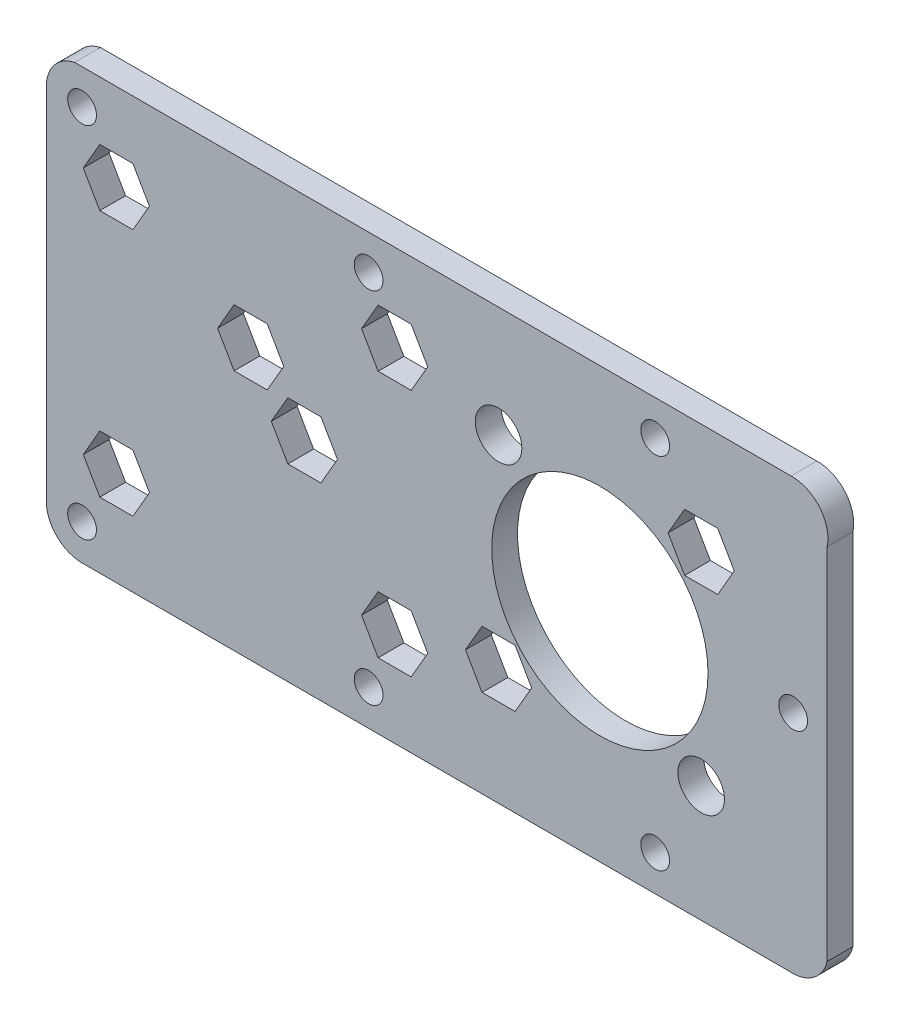
from build123d import *

# Parameters (mm, degrees)
SKETCH1_R           = 2.5527
SKETCH1_R_2         = 4.1275
SKETCH1_R_3         = 19.177
BOSS_EXTRUDE1_DEPTH = 4.572


with BuildPart() as part:
    # Sketch1 → Boss-Extrude1 (new body)
    with BuildSketch(Plane.XY):
        with BuildLine():
            Line((-17.186005785, 5.917481167), (-17.186005785, 69.562080021))
            ThreePointArc((-17.186005785, 69.562080021), (-15.770600509, 73.558612882), (-12.155368019, 75.773503633))
            Line((-12.155368019, 75.773503633), (114.857780393, 75.773503633))
            ThreePointArc((114.857780393, 75.773503633), (119.939137204, 73.478410267), (121.251078966, 68.059328295))
            Line((121.251078966, 68.059328295), (121.251078966, 4.414729441))
            ThreePointArc((121.251078966, 4.414729441), (118.772241914, 0.732566989), (114.487440215, -0.426496367))
            Line((114.487440215, -0.426496367), (-11.1125, -0.426496367))
            ThreePointArc((-11.1125, -0.426496367), (-15.422847741, 1.526196519), (-17.186005785, 5.917481167))
        make_face()
        with Locations((90.763994215, 5.917481167)):
            Circle(SKETCH1_R, mode=Mode.SUBTRACT)
        with Locations((90.763994215, 69.562080021)):
            Circle(SKETCH1_R, mode=Mode.SUBTRACT)
        with Locations((-10.836005785, 69.562080021)):
            Circle(SKETCH1_R, mode=Mode.SUBTRACT)
        with Locations((39.963994215, 69.562080021)):
            Circle(SKETCH1_R, mode=Mode.SUBTRACT)
        with Locations((-10.836005785, 5.917481167)):
            Circle(SKETCH1_R, mode=Mode.SUBTRACT)
        with Locations((39.963994215, 5.917481167)):
            Circle(SKETCH1_R, mode=Mode.SUBTRACT)
        with Locations((63.001987758, 56.151789166)):
            Circle(SKETCH1_R_2, mode=Mode.SUBTRACT)
        with Locations((115.233146458, 39.581556975)):
            Circle(SKETCH1_R, mode=Mode.SUBTRACT)
        with Locations((98.923012242, 20.230764682)):
            Circle(SKETCH1_R_2, mode=Mode.SUBTRACT)
        with Locations((80.9625, 38.1)):
            Circle(SKETCH1_R_3, mode=Mode.SUBTRACT)
        Polygon((1.103378735, 60.325), (-1.829560633, 65.405), (-7.695439367, 65.405), (-10.628378735, 60.325), (-7.695439367, 55.245), (-1.829560633, 55.245), align=None, mode=Mode.SUBTRACT)
        Polygon((50.443227049, 60.325), (47.510287682, 65.405), (41.644408947, 65.405), (38.71146958, 60.325), (41.644408947, 55.245), (47.510287682, 55.245), align=None, mode=Mode.SUBTRACT)
        Polygon((1.103378735, 16.331279268), (-1.829560633, 21.411279268), (-7.695439367, 21.411279268), (-10.628378735, 16.331279268), (-7.695439367, 11.251279268), (-1.829560633, 11.251279268), align=None, mode=Mode.SUBTRACT)
        Polygon((50.443227049, 16.331279268), (47.510287682, 21.411279268), (41.644408947, 21.411279268), (38.71146958, 16.331279268), (41.644408947, 11.251279268), (47.510287682, 11.251279268), align=None, mode=Mode.SUBTRACT)
        Polygon((68.867866493, 20.230764682), (65.934927125, 25.310764682), (60.06904839, 25.310764682), (57.136109023, 20.230764682), (60.06904839, 15.150764682), (65.934927125, 15.150764682), align=None, mode=Mode.SUBTRACT)
        Polygon((104.788890977, 56.151789166), (101.85595161, 61.231789166), (95.990072875, 61.231789166), (93.057133507, 56.151789166), (95.990072875, 51.071789166), (101.85595161, 51.071789166), align=None, mode=Mode.SUBTRACT)
        Polygon((24.915878735, 47.625), (21.982939367, 52.705), (16.117060633, 52.705), (13.184121265, 47.625), (16.117060633, 42.545), (21.982939367, 42.545), align=None, mode=Mode.SUBTRACT)
        Polygon((34.440878735, 38.1), (31.507939367, 43.18), (25.642060633, 43.18), (22.709121265, 38.1), (25.642060633, 33.02), (31.507939367, 33.02), align=None, mode=Mode.SUBTRACT)
    extrude(amount=BOSS_EXTRUDE1_DEPTH)


solid = part.part
